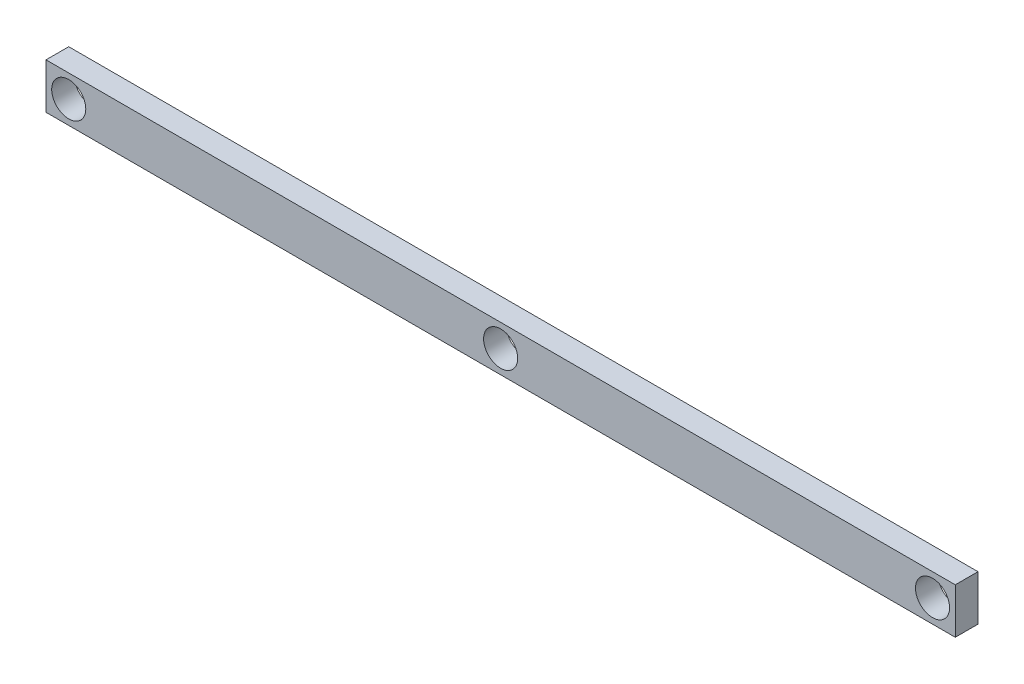
from build123d import *

# Parameters (mm, degrees)
SKETCH1_W           = 40
SKETCH1_H           = 10
BOSS_EXTRUDE1_DEPTH = 2
SKETCH4_W           = 40
SKETCH4_H           = 9
CUT_EXTRUDE2_DEPTH  = 2
SKETCH5_R           = 0.75
CUT_EXTRUDE3_DEPTH  = 41.062451248


with BuildPart() as part:
    # Sketch1 → Boss-Extrude1 (new body)
    with BuildSketch(Plane(origin=(0, 0, 0), x_dir=(1, 0, 0), z_dir=(0, 1, 0))):
        with Locations((20, 5)):
            Rectangle(SKETCH1_W, SKETCH1_H)
    extrude(amount=BOSS_EXTRUDE1_DEPTH)

    # Sketch4 → Cut-Extrude2 (cut)
    with BuildSketch(Plane(origin=(0, 2, 0), x_dir=(1, 0, 0), z_dir=(0, 1, 0))):
        with Locations((20, 5.5)):
            Rectangle(SKETCH4_W, SKETCH4_H)
    extrude(amount=-CUT_EXTRUDE2_DEPTH, mode=Mode.SUBTRACT)

    # Sketch5 → Cut-Extrude3 (cut, through all)
    with BuildSketch(Plane.XY):
        with Locations((20, 1)):
            Circle(SKETCH5_R)
        with Locations((1, 1)):
            Circle(SKETCH5_R)
        with Locations((39, 1)):
            Circle(SKETCH5_R)
    extrude(amount=-CUT_EXTRUDE3_DEPTH, mode=Mode.SUBTRACT)


solid = part.part
